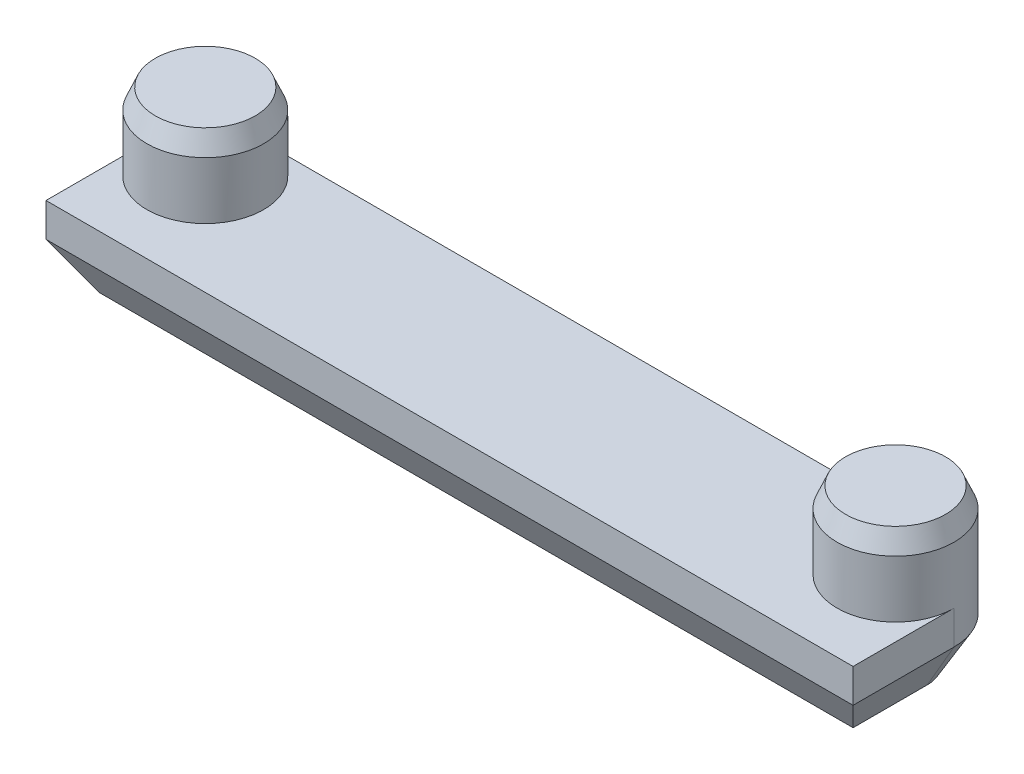
from build123d import *
from OCP.BRepFilletAPI import BRepFilletAPI_MakeChamfer
from build123d.topology import SkipClean

# Parameters (mm, degrees)
SKETCH1_W           = 30.4
SKETCH1_H           = 6
BOSS_EXTRUDE1_DEPTH = 3
SKETCH2_R           = 2.2
BOSS_EXTRUDE2_DEPTH = 2.9
CHAMFER1_SIZE       = 0.75
CHAMFER1_SIZE2      = 0.318356112
CUT_EXTRUDE1_START  = -3
CUT_EXTRUDE1_DEPTH  = 3
CHAMFER2_SIZE       = 1
CHAMFER2_SIZE2      = 1.732050808


with BuildPart() as part:
    # Sketch1 → Boss-Extrude1 (new body)
    with BuildSketch(Plane(origin=(0, 0, 0), x_dir=(1, 0, 0), z_dir=(0, 1, 0))):
        with Locations((15.2, 3)):
            Rectangle(SKETCH1_W, SKETCH1_H)
    extrude(amount=BOSS_EXTRUDE1_DEPTH)

    # Sketch2 → Boss-Extrude2 (add)
    with BuildSketch(Plane(origin=(0, 3, 0), x_dir=(1, 0, 0), z_dir=(0, 1, 0))):
        with Locations(Location((2.2, 3.8, 0), (0, 0, 90))):
            Circle(SKETCH2_R)
        with Locations(Location((28.2, 3.8, 0), (0, 0, 90))):
            Circle(SKETCH2_R)
    extrude(amount=BOSS_EXTRUDE2_DEPTH)

    # Chamfer1: one chamfer whose edges measure the first distance from different faces: ONE call of the kernel's chamfer builder (chamfer() names one face for all edges)
    chamfer1_edges_1 = [part.edges().sort_by_distance(p)[0] for p in [
        (2.2, 5.9, -1.6),
    ]]
    chamfer1_side_1 = [part.faces().sort_by_distance(p)[0] for p in [
        (2.2, 4.45, -1.6),
    ]]
    chamfer1_edges_2 = [part.edges().sort_by_distance(p)[0] for p in [
        (28.2, 5.9, -1.6),
    ]]
    chamfer1_side_2 = [part.faces().sort_by_distance(p)[0] for p in [
        (28.2, 4.45, -1.6),
    ]]
    chamfer1 = BRepFilletAPI_MakeChamfer(part.part.solid().wrapped)
    for e in chamfer1_edges_1:
        chamfer1.Add(CHAMFER1_SIZE, CHAMFER1_SIZE2, e.wrapped, chamfer1_side_1[0].wrapped)  # the first distance lies on this face
    for e in chamfer1_edges_2:
        chamfer1.Add(CHAMFER1_SIZE, CHAMFER1_SIZE2, e.wrapped, chamfer1_side_2[0].wrapped)  # the first distance lies on this face
    add(Compound.cast(chamfer1.Shape()), mode=Mode.REPLACE)

    # Sketch3 → Cut-Extrude1 (cut)
    with SkipClean():  # the faces are left unmerged after this step: merging them gives an invalid solid
        with BuildSketch(Plane(origin=(0, 3, 0), x_dir=(1, 0, 0), z_dir=(0, 1, 0)).offset(CUT_EXTRUDE1_START)):
            with BuildLine():
                Line((30.4, 3.8), (30.4, 6))
                Line((30.4, 6), (28.2, 6))
                ThreePointArc((28.2, 6), (29.755634919, 5.355634919), (30.4, 3.8))
            make_face()
            with BuildLine():
                Line((2.2, 6), (0, 6))
                Line((0, 6), (0, 3.8))
                ThreePointArc((0, 3.8), (0.644365081, 5.355634919), (2.2, 6))
            make_face()
        extrude(amount=CUT_EXTRUDE1_DEPTH, mode=Mode.SUBTRACT)

    # Chamfer2
    chamfer2_edges = [part.edges().sort_by_distance(p)[0] for p in [
        (0, 0, -1.9),
        (15.2, 0, -6),
        (29.755634919, 0, -5.355634919),
        (0.644365081, 0, -5.355634919),
        (30.4, 0, -1.9),
        (15.2, 0, 0),
    ]]
    chamfer2_side = [part.faces().sort_by_distance(p)[0] for p in [
        (15.2, 0, -2.971100636),
    ]]
    chamfer(chamfer2_edges, length=CHAMFER2_SIZE, length2=CHAMFER2_SIZE2, reference=chamfer2_side[0])


solid = part.part
